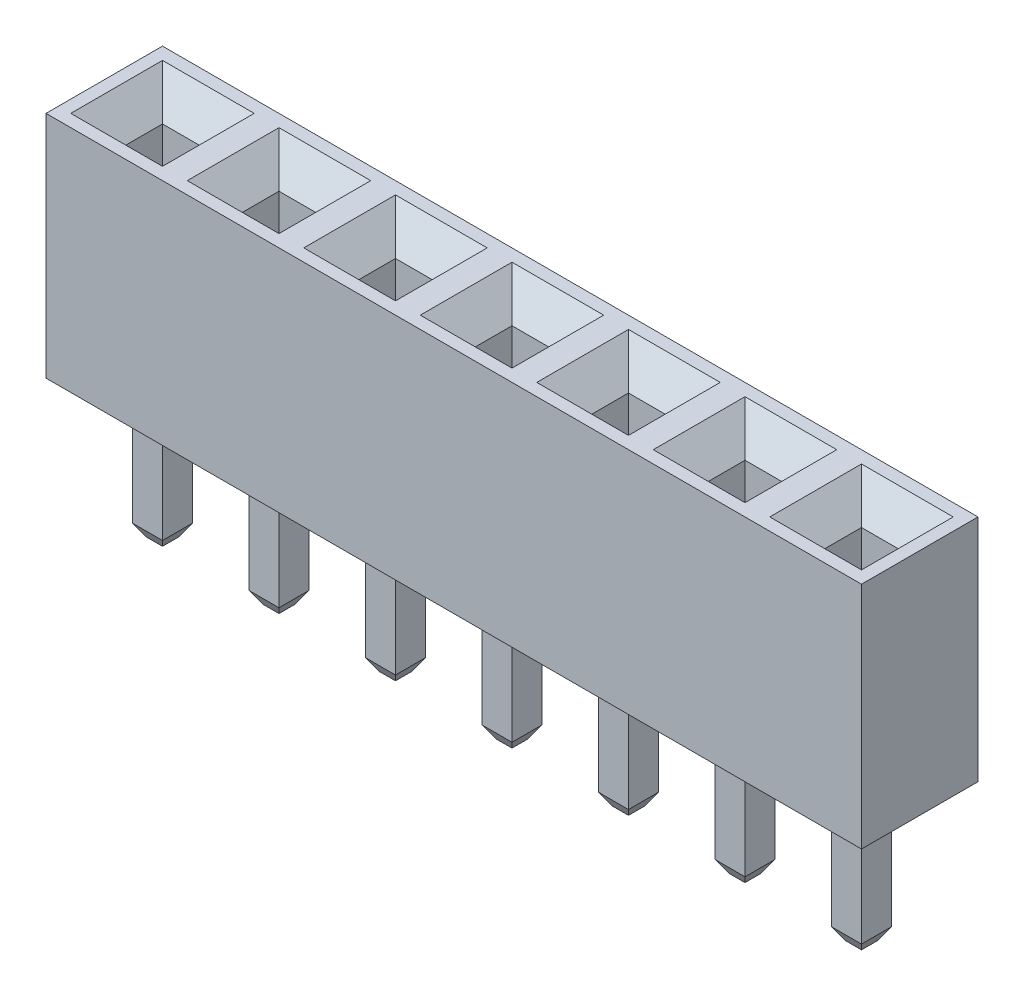
from build123d import *

# Parameters (mm, degrees)
SKETCH1_W                   = 2.54
SKETCH1_H                   = 2.54
BOSS_EXTRUDE1_DEPTH         = 5
SKETCH2_W                   = 0.65
SKETCH2_H                   = 0.65
BOSS_EXTRUDE2_DEPTH         = 3
CHAMFER1_SIZE               = 0.15
CHAMFER1_SIZE2              = 0.259807621
SKETCH3_W                   = 0.8
SKETCH3_H                   = 0.8
CUT_EXTRUDE1_DEPTH          = 3
CHAMFER2_SIZE               = 0.6
LPATTERN1_COUNT             = 7
LPATTERN1_PITCH             = 2.54
CHAMFER1_OF_LPATTERN1_SIZE2 = 0.15
CHAMFER1_OF_LPATTERN1_SIZE  = 0.259807621
CHAMFER2_OF_LPATTERN1_SIZE  = 0.6


with BuildPart() as part:
    # Sketch1 → Boss-Extrude1 (new body)
    with BuildSketch(Plane(origin=(0, 0, 0), x_dir=(1, 0, 0), z_dir=(0, 1, 0))):
        Rectangle(SKETCH1_W, SKETCH1_H)
    boss_extrude1 = extrude(amount=BOSS_EXTRUDE1_DEPTH)

    # Sketch2 → Boss-Extrude2 (add)
    with BuildSketch(Plane.XZ):
        Rectangle(SKETCH2_W, SKETCH2_H)
    boss_extrude2 = extrude(amount=BOSS_EXTRUDE2_DEPTH)

    # Chamfer1
    chamfer1_edges = [part.edges().sort_by_distance(p)[0] for p in [
        (0.325, -3, 0),
        (0, -3, 0.325),
        (-0.325, -3, 0),
        (0, -3, -0.325),
    ]]
    chamfer1_side = [part.faces().sort_by_distance(p)[0] for p in [
        (0, -3, 0),
    ]]
    chamfer(chamfer1_edges, length=CHAMFER1_SIZE, length2=CHAMFER1_SIZE2, reference=chamfer1_side[0])

    # Sketch3 → Cut-Extrude1 (cut)
    with BuildSketch(Plane(origin=(0, 5, 0), x_dir=(1, 0, 0), z_dir=(0, 1, 0))):
        Rectangle(SKETCH3_W, SKETCH3_H)
    cut_extrude1 = extrude(amount=-CUT_EXTRUDE1_DEPTH, mode=Mode.SUBTRACT)

    # Chamfer2
    chamfer2_edges = [part.edges().sort_by_distance(p)[0] for p in [
        (0.4, 5, 0),
        (0, 5, -0.4),
        (-0.4, 5, 0),
        (0, 5, 0.4),
    ]]
    chamfer(chamfer2_edges, length=CHAMFER2_SIZE)

    # LPattern1: Boss-Extrude1, Boss-Extrude2, Cut-Extrude1 ×7
    with Locations(*[(i * LPATTERN1_PITCH, 0, 0) for i in range(1, LPATTERN1_COUNT)]):
        add(boss_extrude1)
        add(boss_extrude2)
        add(cut_extrude1, mode=Mode.SUBTRACT)

    # Chamfer1 of LPattern1
    chamfer1_of_lpattern1_edges = [part.edges().sort_by_distance(p)[0] for p in [
        (2.865, -3, 0),
        (2.54, -3, 0.325),
        (2.215, -3, 0),
        (2.54, -3, -0.325),
        (5.405, -3, 0),
        (5.08, -3, 0.325),
        (4.755, -3, 0),
        (5.08, -3, -0.325),
        (7.945, -3, 0),
        (7.62, -3, 0.325),
        (7.295, -3, 0),
        (7.62, -3, -0.325),
        (10.485, -3, 0),
        (10.16, -3, 0.325),
        (9.835, -3, 0),
        (10.16, -3, -0.325),
        (13.025, -3, 0),
        (12.7, -3, 0.325),
        (12.375, -3, 0),
        (12.7, -3, -0.325),
        (15.565, -3, 0),
        (15.24, -3, 0.325),
        (14.915, -3, 0),
        (15.24, -3, -0.325),
    ]]
    chamfer(chamfer1_of_lpattern1_edges, length=CHAMFER1_OF_LPATTERN1_SIZE, length2=CHAMFER1_OF_LPATTERN1_SIZE2)

    # Chamfer2 of LPattern1
    chamfer2_of_lpattern1_edges = [part.edges().sort_by_distance(p)[0] for p in [
        (2.94, 5, 0),
        (2.54, 5, -0.4),
        (2.14, 5, 0),
        (2.54, 5, 0.4),
        (5.48, 5, 0),
        (5.08, 5, -0.4),
        (4.68, 5, 0),
        (5.08, 5, 0.4),
        (8.02, 5, 0),
        (7.62, 5, -0.4),
        (7.22, 5, 0),
        (7.62, 5, 0.4),
        (10.56, 5, 0),
        (10.16, 5, -0.4),
        (9.76, 5, 0),
        (10.16, 5, 0.4),
        (13.1, 5, 0),
        (12.7, 5, -0.4),
        (12.3, 5, 0),
        (12.7, 5, 0.4),
        (15.64, 5, 0),
        (15.24, 5, -0.4),
        (14.84, 5, 0),
        (15.24, 5, 0.4),
    ]]
    chamfer(chamfer2_of_lpattern1_edges, length=CHAMFER2_OF_LPATTERN1_SIZE)


solid = part.part
